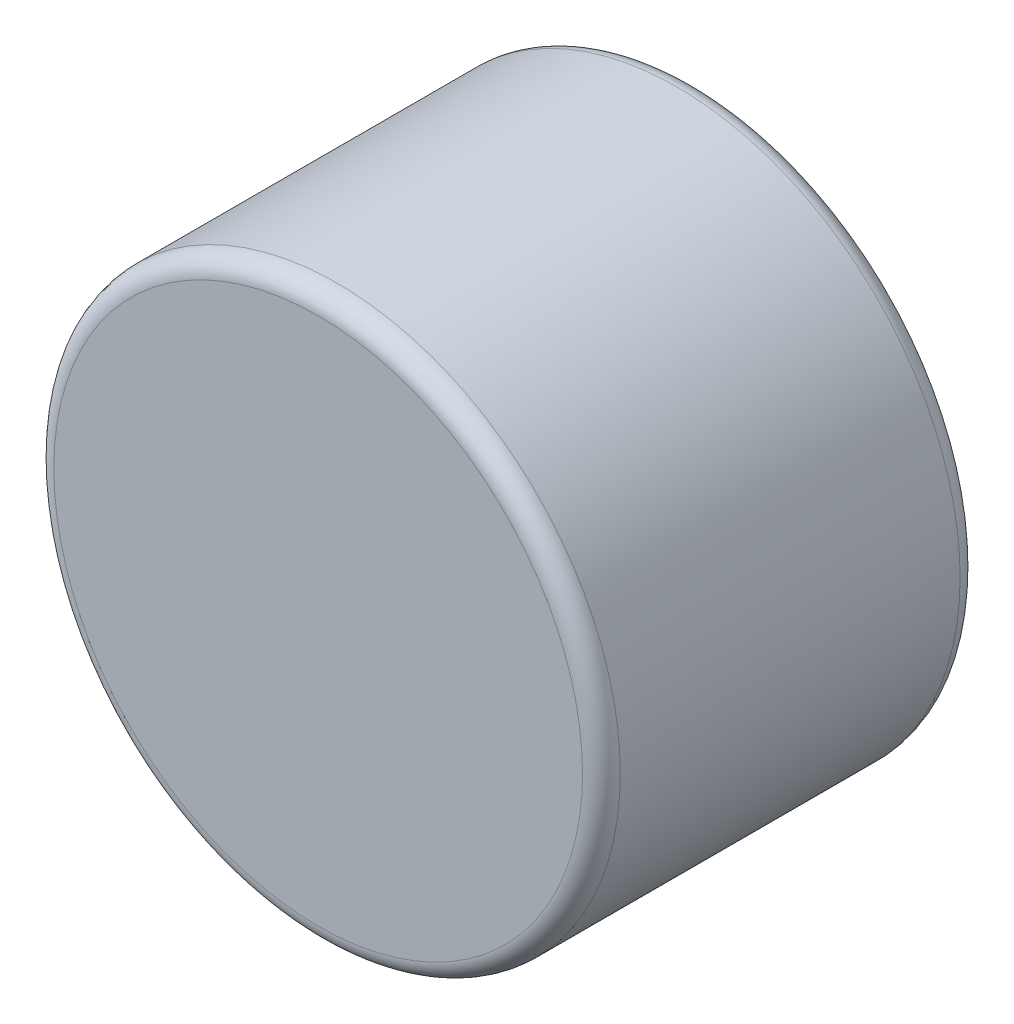
from build123d import *

# Parameters (mm, degrees)
SKETCH_1_R      = 3
EXTRUDE_1_DEPTH = 4
FILLET_1_R      = 0.2


with BuildPart() as part:
    # 草图1 → 凸台-拉伸1 (new body)
    with BuildSketch(Plane.XY):
        Circle(SKETCH_1_R)
    extrude(amount=EXTRUDE_1_DEPTH)

    # 圆角1
    fillet_1_edges = [part.edges().sort_by_distance(p)[0] for p in [
        (-3, 0, 0),
        (-3, 0, 4),
    ]]
    fillet(fillet_1_edges, radius=FILLET_1_R)


solid = part.part
